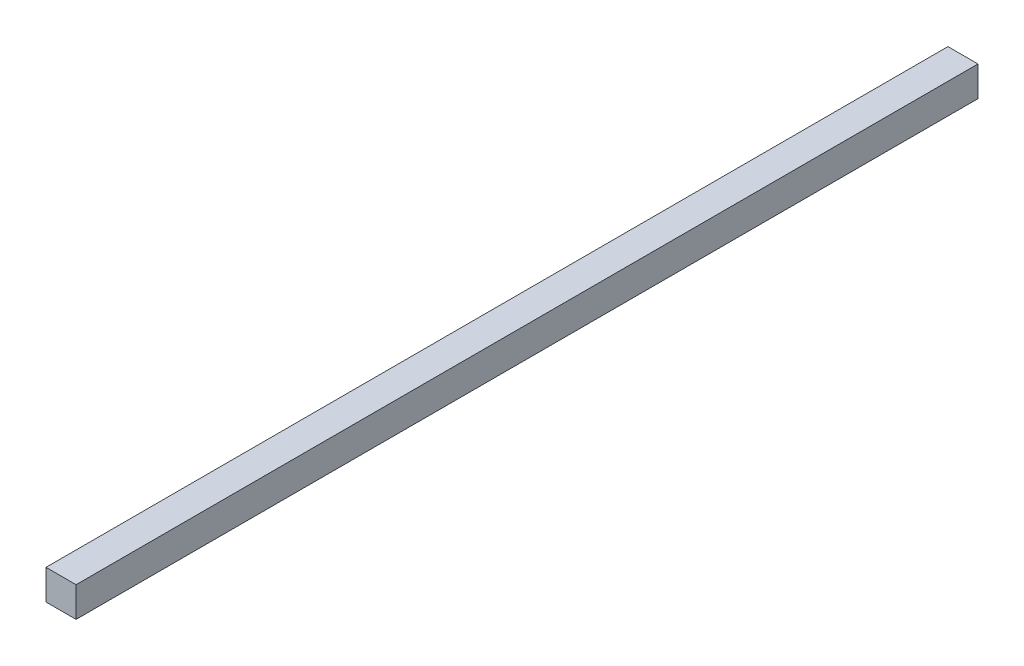
from build123d import *

# Parameters (mm, degrees)
SKETCH1_W           = 6.35
SKETCH1_H           = 6.35
BOSS_EXTRUDE1_DEPTH = 190.5


with BuildPart() as part:
    # Sketch1 → Boss-Extrude1 (new body)
    with BuildSketch(Plane.XY):
        with Locations((3.175, 3.175)):
            Rectangle(SKETCH1_W, SKETCH1_H)
    extrude(amount=BOSS_EXTRUDE1_DEPTH)


solid = part.part
